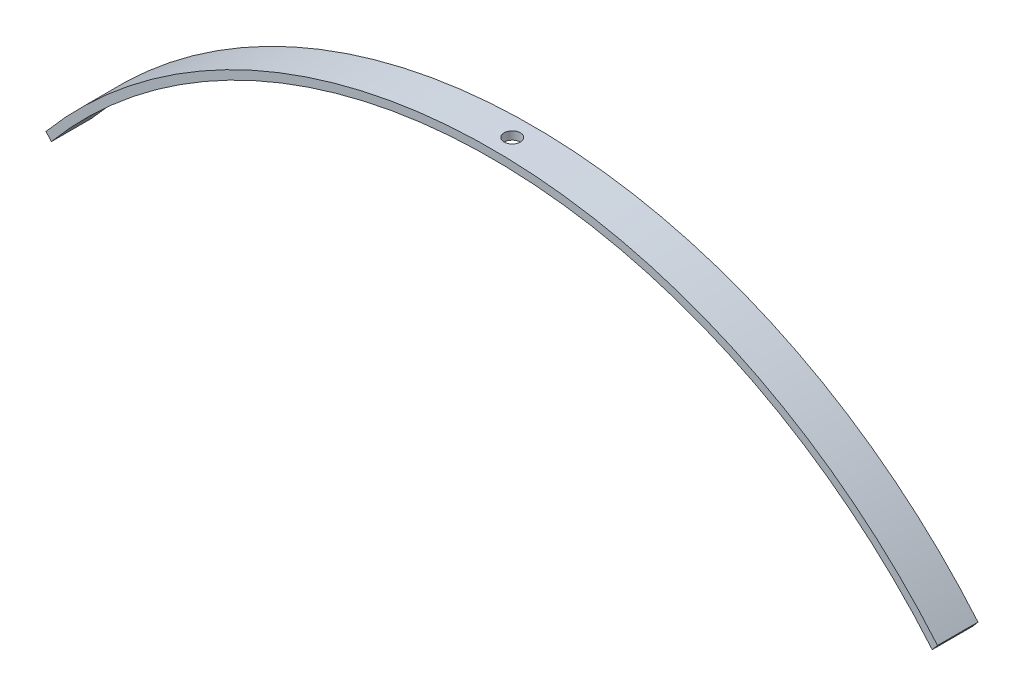
from build123d import *

# Parameters (mm, degrees)
BOSS_EXTRU_1_DEPTH           = 10
ENL_V_MAT_EXTRU_1_REACH      = 183.602
ENL_V_MAT_EXTRU_1_END_RADIUS = 144
ESQUISSE3_R                  = 2


with BuildPart() as part:
    # Esquisse2 → Boss.-Extru.1 (new body)
    with BuildSketch(Plane.XY):
        with BuildLine():
            Line((-108.89070765, 91.141723636), (-110.196113775, 92.697446075))
            ThreePointArc((-110.196113775, 92.697446075), (-0.087455631, 143.999973443), (110.083436481, 92.831228649))
            Line((110.083436481, 92.831228649), (108.778310923, 91.275840575))
            ThreePointArc((108.778310923, 91.275840575), (-0.087493397, 141.999973045), (-108.89070765, 91.141723636))
        make_face()
    extrude(amount=BOSS_EXTRU_1_DEPTH)

    # Enlèv. mat.-Extru.1: up to this cylinder (the profile starts inside it)
    enl_v_mat_extru_1_end = Plane(origin=(0, 0, 5), z_dir=(0, 0, -1)) * Cylinder(ENL_V_MAT_EXTRU_1_END_RADIUS, 656.204, mode=Mode.PRIVATE)
    # Esquisse3 → Enlèv. mat.-Extru.1 (cut, up to the surface)
    with BuildSketch(Plane(origin=(0, 0, 0), x_dir=(1, 0, 0), z_dir=(0, 1, 0)), mode=Mode.PRIVATE) as enl_v_mat_extru_1_sk1:
        with Locations(Location((0, -5, 0), (0, 0, 90))):
            Circle(ESQUISSE3_R)
    enl_v_mat_extru_1_tool1 = extrude(enl_v_mat_extru_1_sk1.sketch, amount=ENL_V_MAT_EXTRU_1_REACH, mode=Mode.PRIVATE) & enl_v_mat_extru_1_end
    add(enl_v_mat_extru_1_tool1.solids().sort_by_distance((0, 0, 5))[0], mode=Mode.SUBTRACT)


solid = part.part
